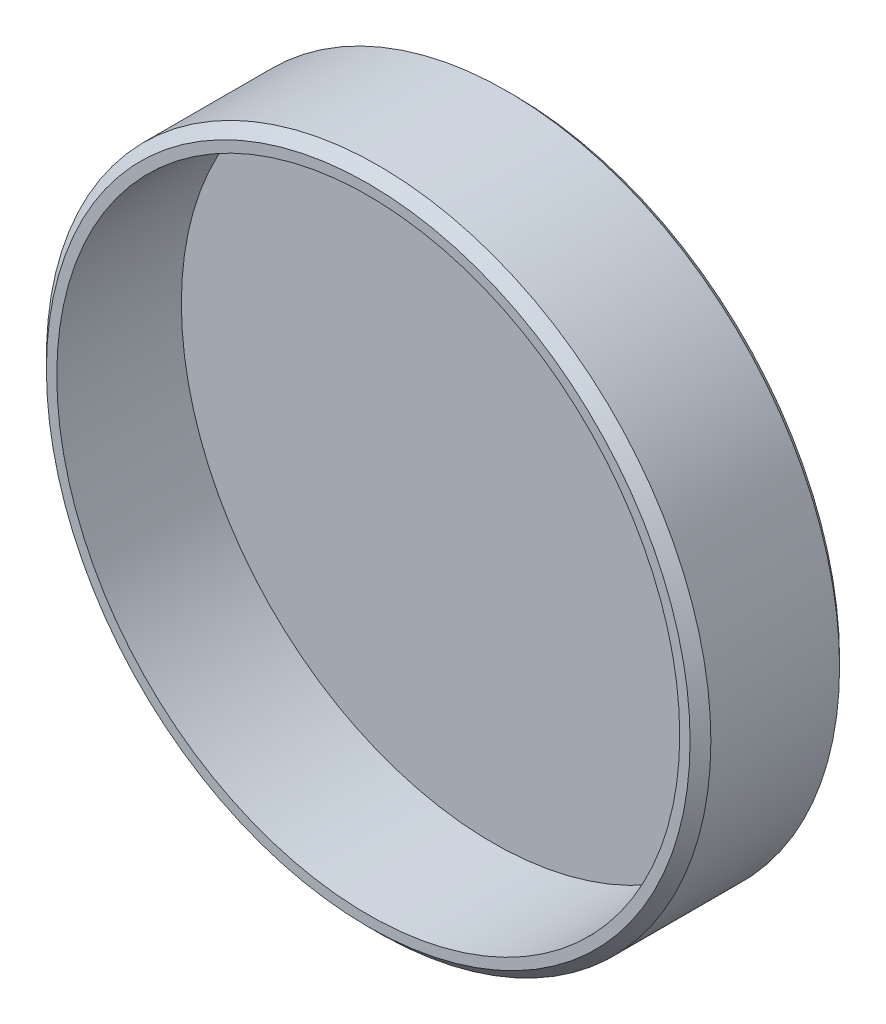
from build123d import *

# Parameters (mm, degrees)
SKICA1_R                 = 16
P_IDAT_VYSUNUT_M1_DEPTH  = 7
SKO_EPINA1_T             = -1
SKICA2_R                 = 13
ODEBRAT_VYSUNUT_M1_DEPTH = 0.1
ZKOSEN_1_SIZE            = 0.5
ZKOSEN_2_SIZE            = 0.3


with BuildPart() as part:
    # Skica1 → Přidat vysunutím1 (new body)
    with BuildSketch(Plane.XY):
        Circle(SKICA1_R)
    extrude(amount=P_IDAT_VYSUNUT_M1_DEPTH)

    # Skořepina1
    sko_epina1_openings = [part.faces().sort_by_distance(p)[0] for p in [
        (0, 0, 7),
    ]]
    offset(amount=SKO_EPINA1_T, openings=sko_epina1_openings, kind=Kind.INTERSECTION)

    # Skica2 → Odebrat vysunutím1 (cut)
    with BuildSketch(Plane(origin=(0, 0, 0), x_dir=(-1, 0, 0), z_dir=(0, 0, -1))):
        Circle(SKICA2_R)
    extrude(amount=-ODEBRAT_VYSUNUT_M1_DEPTH, mode=Mode.SUBTRACT)

    # Zkosení1
    zkosen_1_edges = [part.edges().sort_by_distance(p)[0] for p in [
        (-16, 0, 7),
    ]]
    chamfer(zkosen_1_edges, length=ZKOSEN_1_SIZE)

    # Zkosení2
    zkosen_2_edges = [part.edges().sort_by_distance(p)[0] for p in [
        (-16, 0, 0),
    ]]
    chamfer(zkosen_2_edges, length=ZKOSEN_2_SIZE)


solid = part.part
